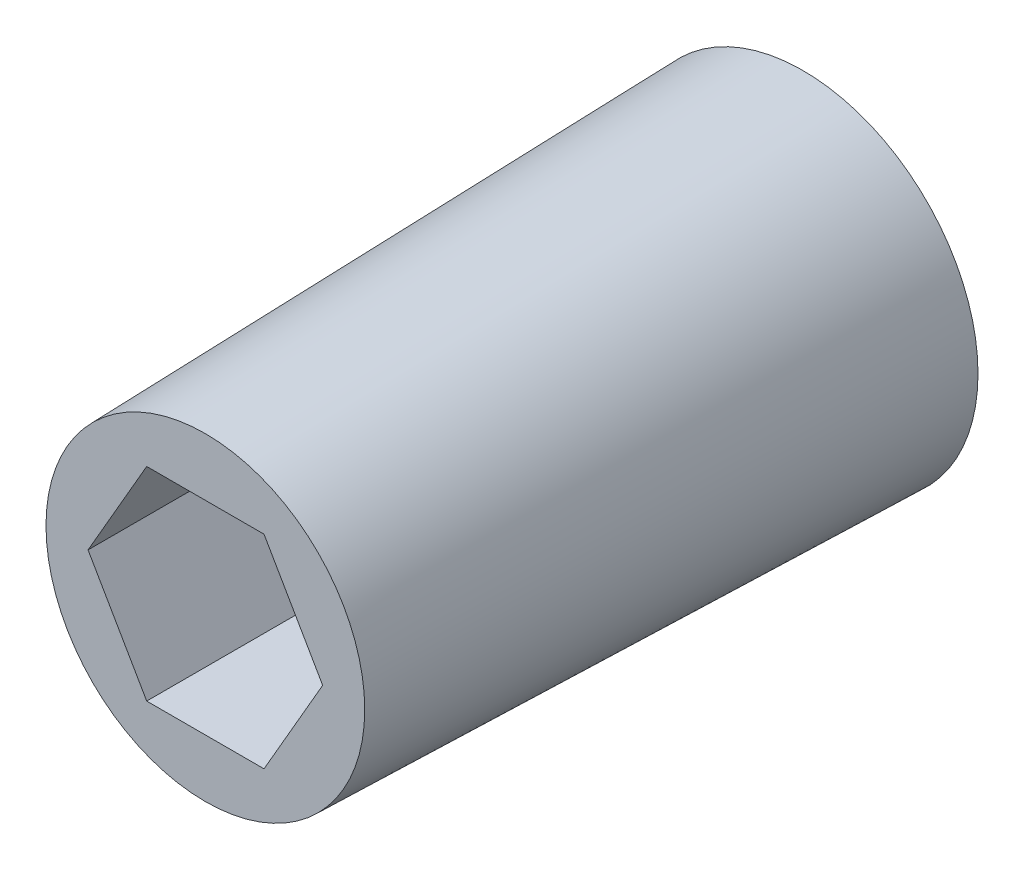
from build123d import *

# Parameters (mm, degrees)
CUT_EXTRUDE1_DEPTH = 17.235553187


with BuildPart() as part:
    # Sketch1 → Revolve1 (revolve)
    with BuildSketch(Plane(origin=(0, 0, 0), x_dir=(1, 0, 0), z_dir=(0, 1, 0))):
        Polygon((4.392788823, 7.5), (0, 7.5), (0, -7.5), (4, -7.5), align=None)
    revolve(axis=Axis((0, 0, -7.5), (0, 0, 1)))

    # Sketch2 → Cut-Extrude1 (cut, through all)
    with BuildSketch(Plane(origin=(0, 0, -7.5), x_dir=(-1, 0, 0), z_dir=(0, 0, -1))):
        Polygon((-2.944486373, 0), (-1.472243186, -2.55), (1.472243186, -2.55), (2.944486373, 0), (1.472243186, 2.55), (-1.472243186, 2.55), align=None)
    extrude(amount=-CUT_EXTRUDE1_DEPTH, mode=Mode.SUBTRACT)


solid = part.part
